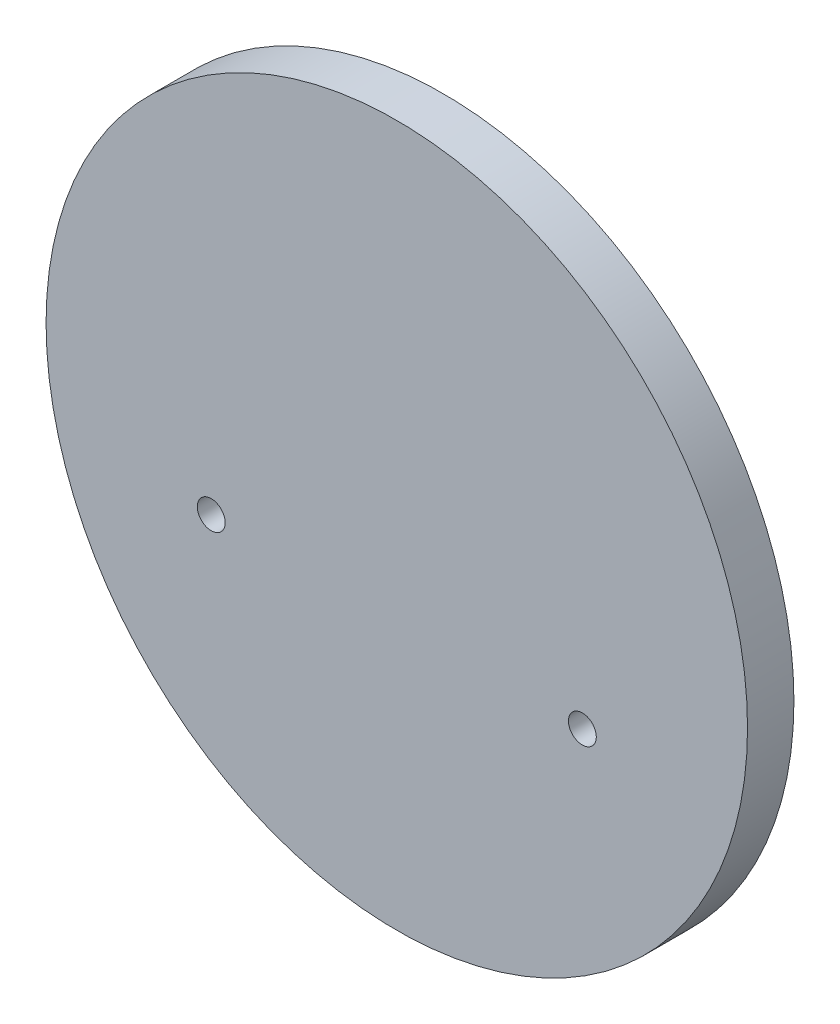
from build123d import *

# Parameters (mm, degrees)
SKETCH1_R           = 37.8
SKETCH1_R_2         = 1.5
BOSS_EXTRUDE1_DEPTH = 5


with BuildPart() as part:
    # Sketch1 → Boss-Extrude1 (new body)
    with BuildSketch(Plane.XY):
        Circle(SKETCH1_R)
        with Locations((-20, -9)):
            Circle(SKETCH1_R_2, mode=Mode.SUBTRACT)
        with Locations((20, -9)):
            Circle(SKETCH1_R_2, mode=Mode.SUBTRACT)
    extrude(amount=BOSS_EXTRUDE1_DEPTH)


solid = part.part
